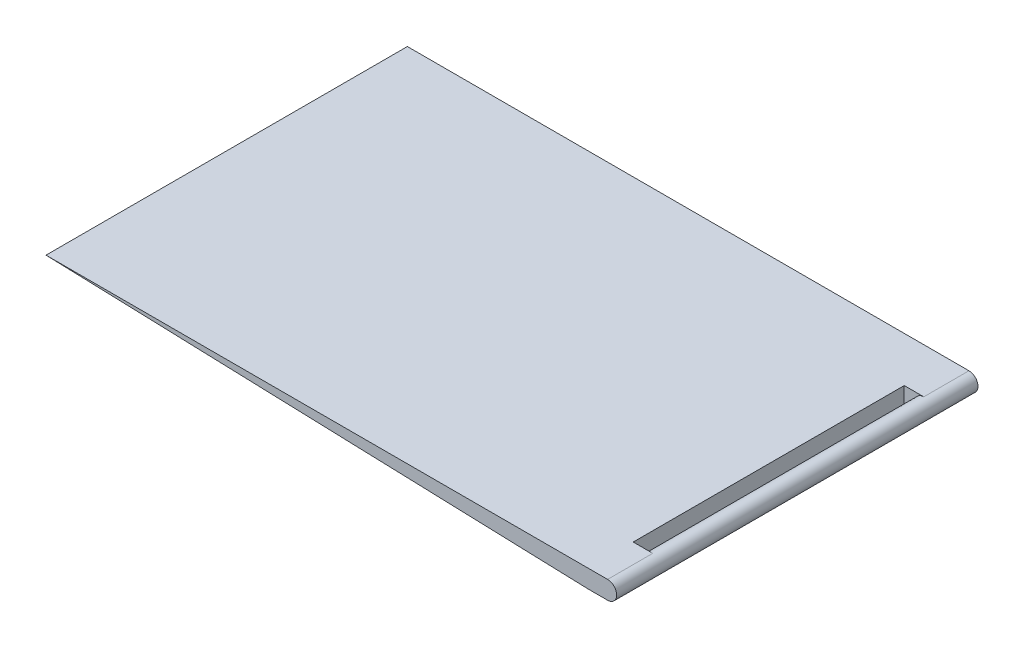
from build123d import *

# Parameters (mm, degrees)
BOSS_EXTRU_1_DEPTH      = 20
BOSS_EXTRU_1_DEPTH_BACK = 20
ESQUISSE1_R             = 1
BOSS_EXTRU_2_DEPTH      = 40
ESQUISSE3_W             = 2.163419692
ESQUISSE3_H             = 2
BOSS_EXTRU_3_DEPTH      = 5
ESQUISSE4_W             = 2.163419692
ESQUISSE4_H             = 2
BOSS_EXTRU_4_DEPTH      = 5


with BuildPart() as part:
    # Esquisse1 → Boss.-Extru.1 (new, two sides: drawn at the far end of the back side and taken through both)
    with BuildSketch(Plane.XY.offset(-BOSS_EXTRU_1_DEPTH_BACK)):
        Circle(ESQUISSE1_R)
    extrude(amount=BOSS_EXTRU_1_DEPTH + BOSS_EXTRU_1_DEPTH_BACK)



with BuildPart() as body_2:
    # Esquisse2 → Boss.-Extru.2 (new body)
    with BuildSketch(Plane.XY.offset(20)):
        Polygon((-2.163419692, -1), (-62.163419692, 1), (-2.163419692, 1), align=None)
    extrude(amount=-BOSS_EXTRU_2_DEPTH)


with BuildPart() as part_1:
    add(part.part)

    add(body_2.part)  # Boss.-Extru.3 merges body 2
    # Esquisse3 → Boss.-Extru.3 (add)
    with BuildSketch(Plane.XY.offset(20)):
        with Locations((-1.081709846, 0)):
            Rectangle(ESQUISSE3_W, ESQUISSE3_H)
    extrude(amount=-BOSS_EXTRU_3_DEPTH)

    # Esquisse4 → Boss.-Extru.4 (add)
    with BuildSketch(Plane(origin=(0, 0, -20), x_dir=(-1, 0, 0), z_dir=(0, 0, -1))):
        with Locations((1.081709846, 0)):
            Rectangle(ESQUISSE4_W, ESQUISSE4_H)
    extrude(amount=-BOSS_EXTRU_4_DEPTH)


solid = part_1.part
